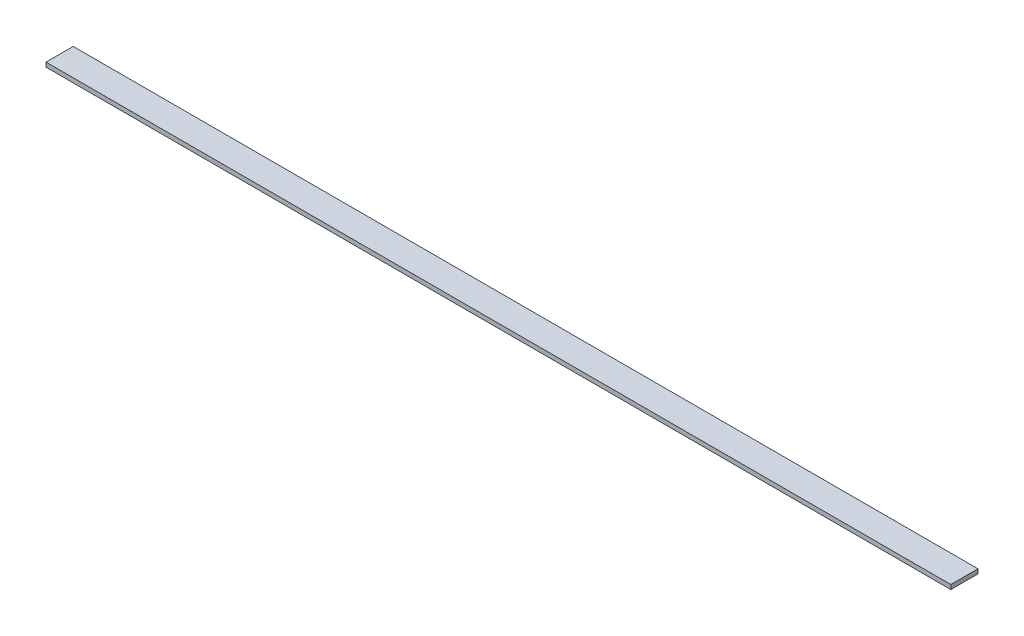
from build123d import *

# Parameters (mm, degrees)
SKETCH1_W           = 4437.0625
SKETCH1_H           = 133.35
BOSS_EXTRUDE1_DEPTH = 21.59


with BuildPart() as part:
    # Sketch1 → Boss-Extrude1 (new body)
    with BuildSketch(Plane(origin=(0, 0, 0), x_dir=(1, 0, 0), z_dir=(0, 1, 0))):
        with Locations((42.768893413, 465.998586118)):
            Rectangle(SKETCH1_W, SKETCH1_H)
    extrude(amount=BOSS_EXTRUDE1_DEPTH)


solid = part.part
